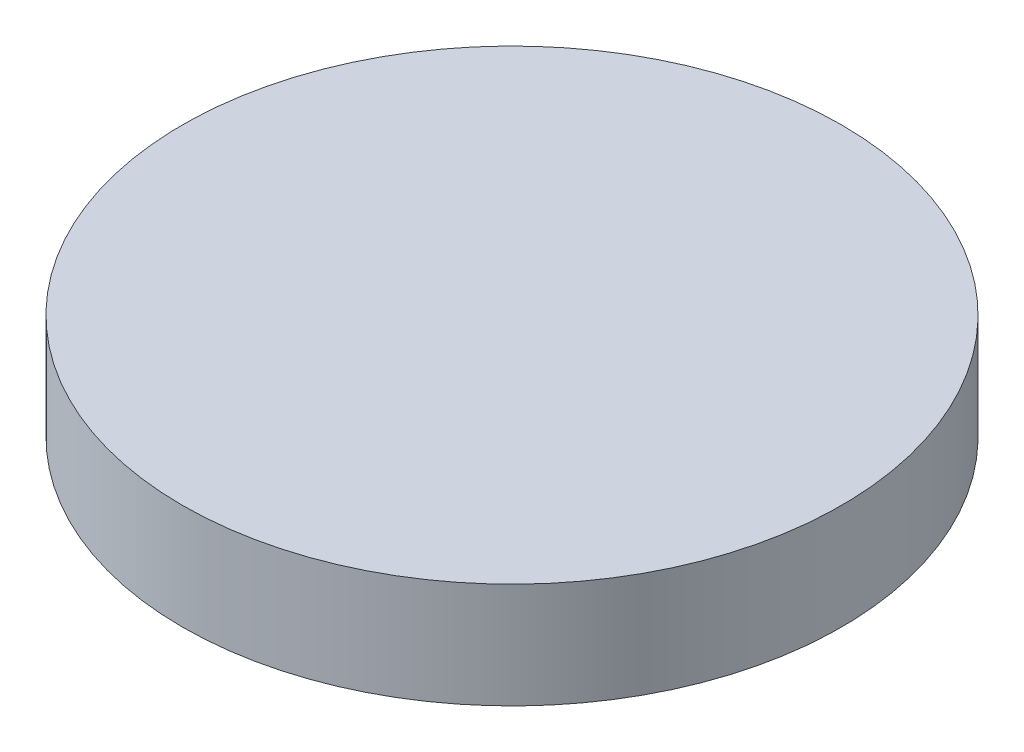
from build123d import *

# Parameters (mm, degrees)
SKETCH1_R           = 12.5
BOSS_EXTRUDE1_DEPTH = 4


with BuildPart() as part:
    # Sketch1 → Boss-Extrude1 (new body)
    with BuildSketch(Plane(origin=(0, 0, 0), x_dir=(1, 0, 0), z_dir=(0, 1, 0))):
        with Locations(Location((0, 0, 0), (0, 0, 270))):
            Circle(SKETCH1_R)
    extrude(amount=BOSS_EXTRUDE1_DEPTH)


solid = part.part
